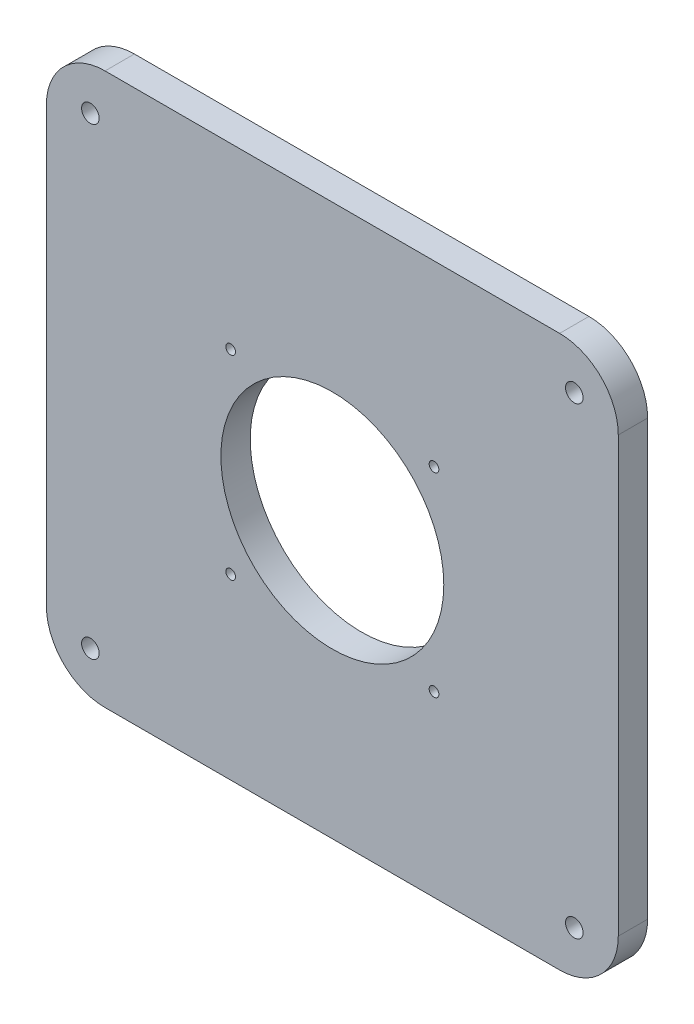
from build123d import *

# Parameters (mm, degrees)
SKETCH1_W           = 195
SKETCH1_H           = 188
SKETCH1_R           = 3
SKETCH1_R_2         = 38
SKETCH1_R_3         = 1.65
BOSS_EXTRUDE1_DEPTH = 10
FILLET1_R           = 20


with BuildPart() as part:
    # Sketch1 → Boss-Extrude1 (new body)
    with BuildSketch(Plane.XY):
        with Locations((82.5, 79)):
            Rectangle(SKETCH1_W, SKETCH1_H)
        with Locations((165, 0)):
            Circle(SKETCH1_R, mode=Mode.SUBTRACT)
        with Locations((165, 158)):
            Circle(SKETCH1_R, mode=Mode.SUBTRACT)
        with Locations((0, 158)):
            Circle(SKETCH1_R, mode=Mode.SUBTRACT)
        Circle(SKETCH1_R, mode=Mode.SUBTRACT)
        with Locations((82.5, 79)):
            Circle(SKETCH1_R_2, mode=Mode.SUBTRACT)
        with Locations((117.168551284, 112.19776426)):
            Circle(SKETCH1_R_3, mode=Mode.SUBTRACT)
        with Locations((47.831448716, 112.19776426)):
            Circle(SKETCH1_R_3, mode=Mode.SUBTRACT)
        with Locations((47.831448716, 45.80223574)):
            Circle(SKETCH1_R_3, mode=Mode.SUBTRACT)
        with Locations((117.168551284, 45.80223574)):
            Circle(SKETCH1_R_3, mode=Mode.SUBTRACT)
    extrude(amount=BOSS_EXTRUDE1_DEPTH)

    # Fillet1
    fillet1_edges = [part.edges().sort_by_distance(p)[0] for p in [
        (-15, 173, 5),
        (180, 173, 5),
        (180, -15, 5),
        (-15, -15, 5),
    ]]
    fillet(fillet1_edges, radius=FILLET1_R)


solid = part.part
